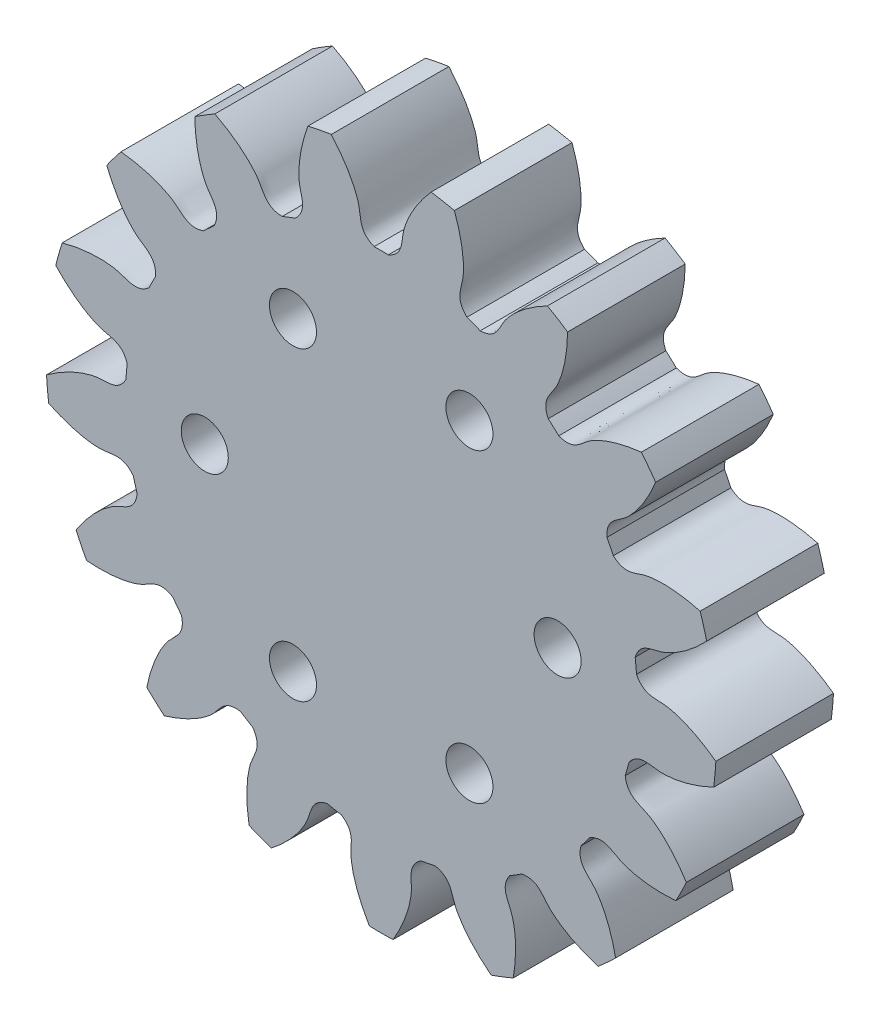
from build123d import *

# Parameters (mm, degrees)
SKETCH_1_R               = 28.5
EXTRUDE_1_DEPTH          = 10
CUT_EXTRUDE_1_DEPTH      = 42.527099586
PATTERN_CIRCULAR_1_COUNT = 17
SKETCH_4_R               = 2
CUT_EXTRUDE_2_DEPTH      = 42.495288115


with BuildPart() as part:
    # 草图1 → 凸台-拉伸1 (new body)
    with BuildSketch(Plane.XY):
        Circle(SKETCH_1_R)
    extrude(amount=EXTRUDE_1_DEPTH)

    # 草图2 → 切除-拉伸1 (cut, through all)
    with BuildSketch(Plane.XY):
        with BuildLine():
            ThreePointArc((0.605081241, 21.741581743), (0, 21.75), (-0.605081241, 21.741581743))
            add(Edge.make_bspline(
                [(-0.605081241, 21.741581743), (-1.883639221, 22.274466064), (-1.698586134, 23.26444022), (-1.914916814, 24.194472413), (-1.934927203, 24.273451785), (-1.959055508, 24.361257941), (-1.98765177, 24.457755998), (-2.021075333, 24.562798091), (-2.059677239, 24.676226272), (-2.103805336, 24.797871753), (-2.153802336, 24.927555282), (-2.210006036, 25.065087193), (-2.272748892, 25.210267559), (-2.342357782, 25.362886323), (-2.419153727, 25.522723443), (-2.503451625, 25.689549046), (-2.595559985, 25.863123583), (-2.695780667, 26.043197999), (-2.804408627, 26.2295139), (-2.921731664, 26.421803731), (-3.048030173, 26.619790963), (-3.1835769, 26.823190282), (-3.328636707, 27.031707786), (-3.483466335, 27.245041186), (-3.648314178, 27.462880017), (-3.823420057, 27.684905848), (-4.009015004, 27.910792508), (-4.20532105, 28.140206308), (-4.412551012, 28.372806269), (-4.630908298, 28.608244364), (-4.86058671, 28.846165754), (-5.101770249, 29.086209039), (-5.354632937, 29.328006505), (-5.619338636, 29.571184379), (-5.896040878, 29.815363096), (-6.184882696, 30.060157557), (-6.485996473, 30.305177399), (-6.799503782, 30.550027271), (-7.125515246, 30.794307109), (-7.464130392, 31.037612419), (-7.815437541, 31.279534556), (-8.179513603, 31.519661024), (-8.687464904, 31.8402916), (-9.079730706, 32.071577913), (-9.346937499, 32.222157355)],
                knots=[0, 0, 0, 0, 0.193882922, 0.199023975, 0.204850501, 0.211362501, 0.218559975, 0.226442923, 0.235011345, 0.24426524, 0.254204608, 0.264829451, 0.276139767, 0.288135557, 0.300816821, 0.314183558, 0.328235769, 0.342973453, 0.358396612, 0.374505244, 0.39129935, 0.408778929, 0.426943982, 0.445794509, 0.46533051, 0.485551984, 0.506458932, 0.528051354, 0.550329249, 0.573292619, 0.596941461, 0.621275778, 0.646295568, 0.672000832, 0.69839157, 0.725467781, 0.753229466, 0.781676625, 0.810809257, 0.840627364, 0.871130943, 0.902319997, 0.934194524, 1, 1, 1, 1], degree=3))
            ThreePointArc((-9.346937499, 32.222157355), (0, 33.550449553), (9.346937499, 32.222157355))
            add(Edge.make_bspline(
                [(0.605081241, 21.741581743), (1.883639221, 22.274466064), (1.698586134, 23.26444022), (1.914916814, 24.194472413), (1.934927203, 24.273451785), (1.959055508, 24.361257941), (1.98765177, 24.457755998), (2.021075333, 24.562798091), (2.059677239, 24.676226272), (2.103805336, 24.797871753), (2.153802336, 24.927555282), (2.210006036, 25.065087193), (2.272748892, 25.210267559), (2.342357782, 25.362886323), (2.419153727, 25.522723443), (2.503451625, 25.689549046), (2.595559985, 25.863123583), (2.695780667, 26.043197999), (2.804408627, 26.2295139), (2.921731664, 26.421803731), (3.048030173, 26.619790963), (3.1835769, 26.823190282), (3.328636707, 27.031707786), (3.483466335, 27.245041186), (3.648314178, 27.462880017), (3.823420057, 27.684905848), (4.009015004, 27.910792508), (4.20532105, 28.140206308), (4.412551012, 28.372806269), (4.630908298, 28.608244364), (4.86058671, 28.846165754), (5.101770249, 29.086209039), (5.354632937, 29.328006505), (5.619338636, 29.571184379), (5.896040878, 29.815363096), (6.184882696, 30.060157557), (6.485996473, 30.305177399), (6.799503782, 30.550027271), (7.125515246, 30.794307109), (7.464130392, 31.037612419), (7.815437541, 31.279534556), (8.179513603, 31.519661024), (8.687464904, 31.8402916), (9.079730706, 32.071577913), (9.346937499, 32.222157355)],
                knots=[0, 0, 0, 0, 0.193882922, 0.199023975, 0.204850501, 0.211362501, 0.218559975, 0.226442923, 0.235011345, 0.24426524, 0.254204608, 0.264829451, 0.276139767, 0.288135557, 0.300816821, 0.314183558, 0.328235769, 0.342973453, 0.358396612, 0.374505244, 0.39129935, 0.408778929, 0.426943982, 0.445794509, 0.46533051, 0.485551984, 0.506458932, 0.528051354, 0.550329249, 0.573292619, 0.596941461, 0.621275778, 0.646295568, 0.672000832, 0.69839157, 0.725467781, 0.753229466, 0.781676625, 0.810809257, 0.840627364, 0.871130943, 0.902319997, 0.934194524, 1, 1, 1, 1], degree=3))
        make_face()
    cut_extrude_1 = extrude(amount=CUT_EXTRUDE_1_DEPTH, mode=Mode.SUBTRACT)

    # 阵列(圆周)1: 切除-拉伸1 ×17 about axis
    pattern_circular_1_axis = Axis((0, 0, 10), (0, 0, -1))
    for i in range(1, PATTERN_CIRCULAR_1_COUNT):
        add(cut_extrude_1.rotate(pattern_circular_1_axis, i * 360 / PATTERN_CIRCULAR_1_COUNT), mode=Mode.SUBTRACT)

    # 草图4 → 切除-拉伸2 (cut, through all)
    with BuildSketch(Plane.XY.offset(10)):
        with Locations((-15, 0)):
            Circle(SKETCH_4_R)
        with Locations((-7.5, 12.990381057)):
            Circle(SKETCH_4_R)
        with Locations((7.5, 12.990381057)):
            Circle(SKETCH_4_R)
        with Locations((15, 0)):
            Circle(SKETCH_4_R)
        with Locations((7.5, -12.990381057)):
            Circle(SKETCH_4_R)
        with Locations((-7.5, -12.990381057)):
            Circle(SKETCH_4_R)
    extrude(amount=-CUT_EXTRUDE_2_DEPTH, mode=Mode.SUBTRACT)


solid = part.part
